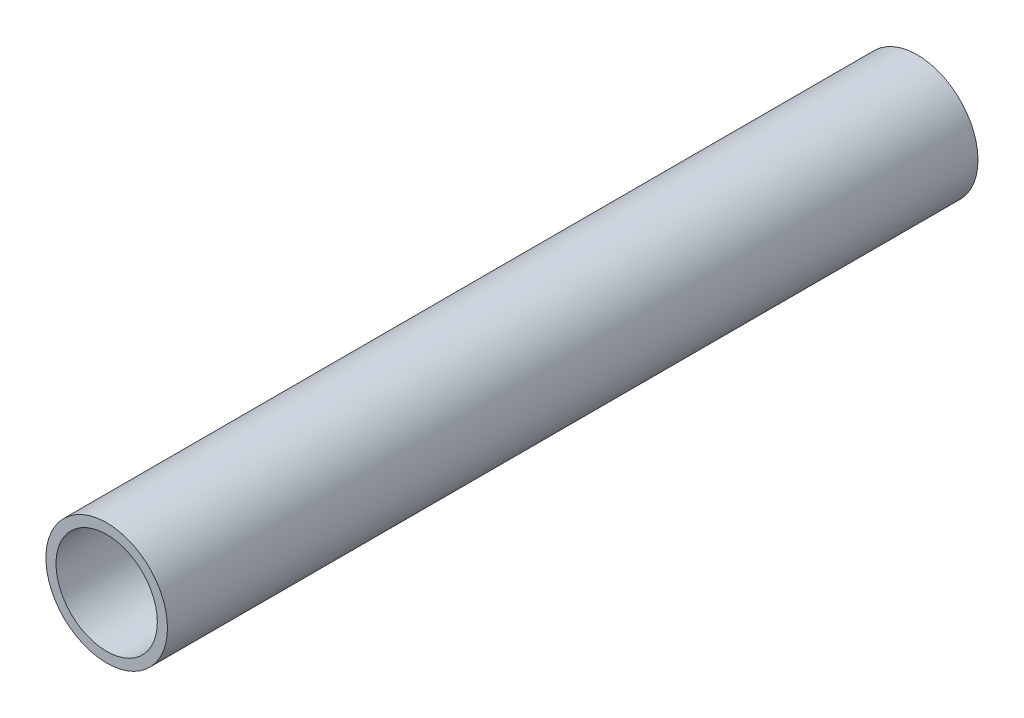
from build123d import *

# Parameters (mm, degrees)
SKETCH1_R           = 6
SKETCH1_R_2         = 5
BOSS_EXTRUDE1_DEPTH = 80


with BuildPart() as part:
    # Sketch1 → Boss-Extrude1 (new body)
    with BuildSketch(Plane.XY):
        Circle(SKETCH1_R)
        Circle(SKETCH1_R_2, mode=Mode.SUBTRACT)
    extrude(amount=BOSS_EXTRUDE1_DEPTH)


solid = part.part
